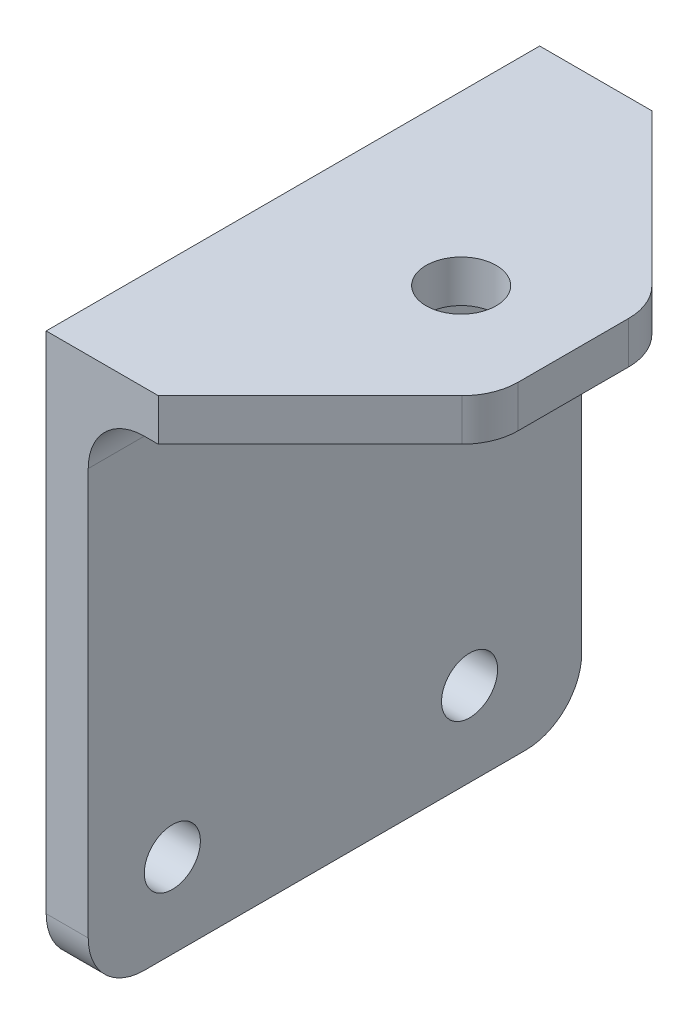
from build123d import *

# Parameters (mm, degrees)
BOSS_EXTRUDE1_DEPTH = 55.88
SKETCH2_R           = 3.96875
CUT_EXTRUDE1_DEPTH  = 31.75
SKETCH3_R           = 3.175
CUT_EXTRUDE2_DEPTH  = 31.75
CUT_EXTRUDE3_DEPTH  = 91.348696172
FILLET2_R           = 6.35


with BuildPart() as part:
    # Sketch1 → Boss-Extrude1 (new body)
    with BuildSketch(Plane.XY):
        with BuildLine():
            Line((0, 0), (0, -63.5))
            Line((0, -63.5), (4.7625, -63.5))
            Line((4.7625, -63.5), (4.7625, -11.1125))
            ThreePointArc((4.7625, -11.1125), (6.622371939, -6.622371939), (11.1125, -4.7625))
            Line((11.1125, -4.7625), (31.75, -4.7625))
            Line((31.75, -4.7625), (31.75, 0))
            Line((31.75, 0), (0, 0))
        make_face()
    extrude(amount=BOSS_EXTRUDE1_DEPTH)

    # Sketch2 → Cut-Extrude1 (cut)
    with BuildSketch(Plane(origin=(0, 0, 0), x_dir=(1, 0, 0), z_dir=(0, 1, 0))):
        with Locations(Location((19.05, -27.94, 0), (0, 0, 270))):
            Circle(SKETCH2_R)
    extrude(amount=-CUT_EXTRUDE1_DEPTH, mode=Mode.SUBTRACT)

    # Sketch3 → Cut-Extrude2 (cut)
    with BuildSketch(Plane(origin=(4.7625, 0, 0), x_dir=(0, 0, -1), z_dir=(1, 0, 0))):
        with Locations((-46.355, -53.975)):
            Circle(SKETCH3_R)
        with Locations((-12.7, -53.975)):
            Circle(SKETCH3_R)
    extrude(amount=-CUT_EXTRUDE2_DEPTH, mode=Mode.SUBTRACT)

    # Sketch4 → Cut-Extrude3 (cut, through all)
    with BuildSketch(Plane(origin=(0, 0, 0), x_dir=(1, 0, 0), z_dir=(0, 1, 0))):
        Polygon((12.7, -55.88), (31.75, -36.83), (31.75, -55.88), align=None)
        Polygon((12.7, 0), (31.75, -19.05), (31.75, 0), align=None)
    extrude(amount=-CUT_EXTRUDE3_DEPTH, mode=Mode.SUBTRACT)

    # Fillet2
    fillet2_edges = [part.edges().sort_by_distance(p)[0] for p in [
        (2.38125, -63.5, 55.88),
        (31.75, -2.38125, 36.83),
        (31.75, -2.38125, 19.05),
        (2.38125, -63.5, 0),
    ]]
    fillet(fillet2_edges, radius=FILLET2_R)


solid = part.part
